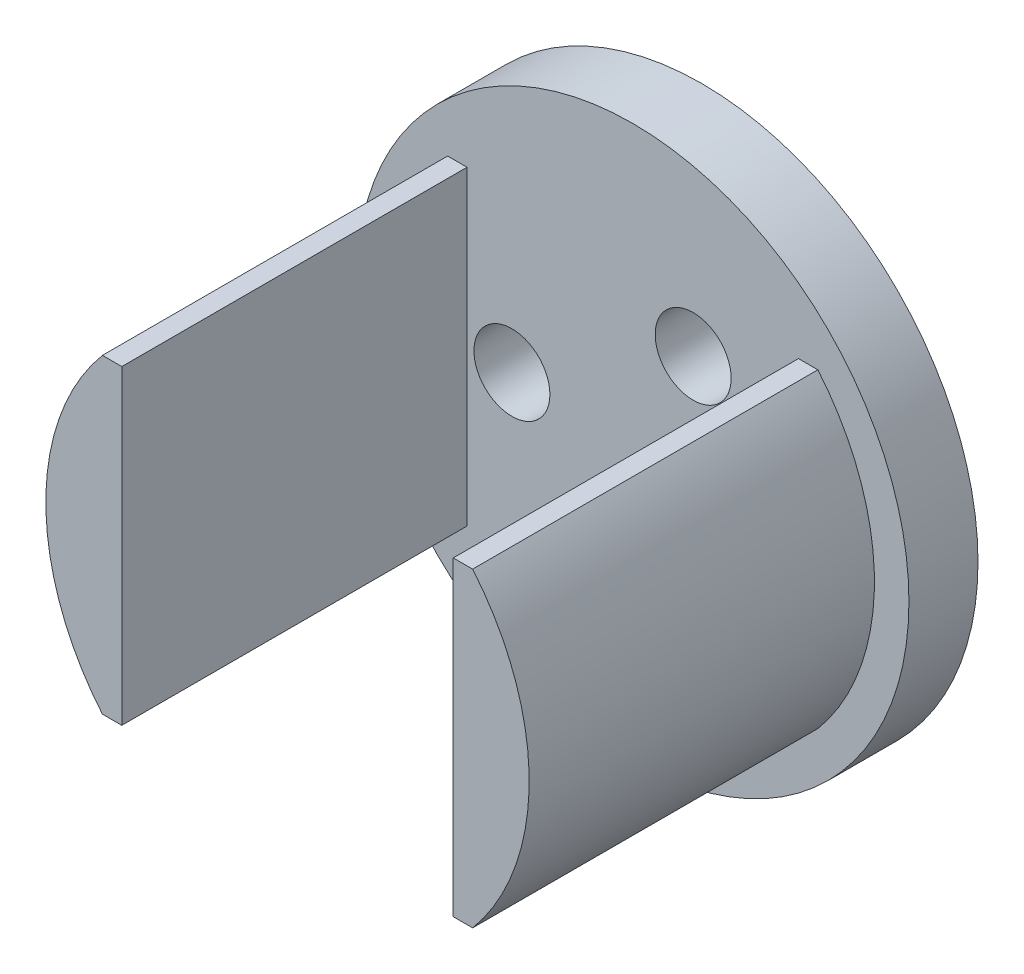
from build123d import *

# Parameters (mm, degrees)
SKETCH1_R           = 8
SKETCH1_R_2         = 1.1
BOSS_EXTRUDE1_DEPTH = 2
BOSS_EXTRUDE2_DEPTH = 10


with BuildPart() as part:
    # Sketch1 → Boss-Extrude1 (new body)
    with BuildSketch(Plane.XY):
        Circle(SKETCH1_R)
        with Locations((-3.5, 0)):
            Circle(SKETCH1_R_2, mode=Mode.SUBTRACT)
        with Locations((1.75, 3.031088913)):
            Circle(SKETCH1_R_2, mode=Mode.SUBTRACT)
        with Locations((1.75, -3.031088913)):
            Circle(SKETCH1_R_2, mode=Mode.SUBTRACT)
    extrude(amount=BOSS_EXTRUDE1_DEPTH)

    # Sketch2 → Boss-Extrude2 (add)
    with BuildSketch(Plane.XY.offset(2)):
        with BuildLine():
            Line((-4.8, 4.5), (-5.361902647, 4.5))
            ThreePointArc((-5.361902647, 4.5), (-7, 0), (-5.361902647, -4.5))
            Line((-5.361902647, -4.5), (-4.8, -4.5))
            Line((-4.8, -4.5), (-4.8, 4.5))
        make_face()
        with BuildLine():
            ThreePointArc((7, 0), (6.577739678, 2.394439545), (5.361902647, 4.5))
            Line((5.361902647, 4.5), (4.8, 4.5))
            Line((4.8, 4.5), (4.8, -4.5))
            Line((4.8, -4.5), (5.361902647, -4.5))
            ThreePointArc((5.361902647, -4.5), (6.577739678, -2.394439545), (7, 0))
        make_face()
    extrude(amount=BOSS_EXTRUDE2_DEPTH)


solid = part.part
